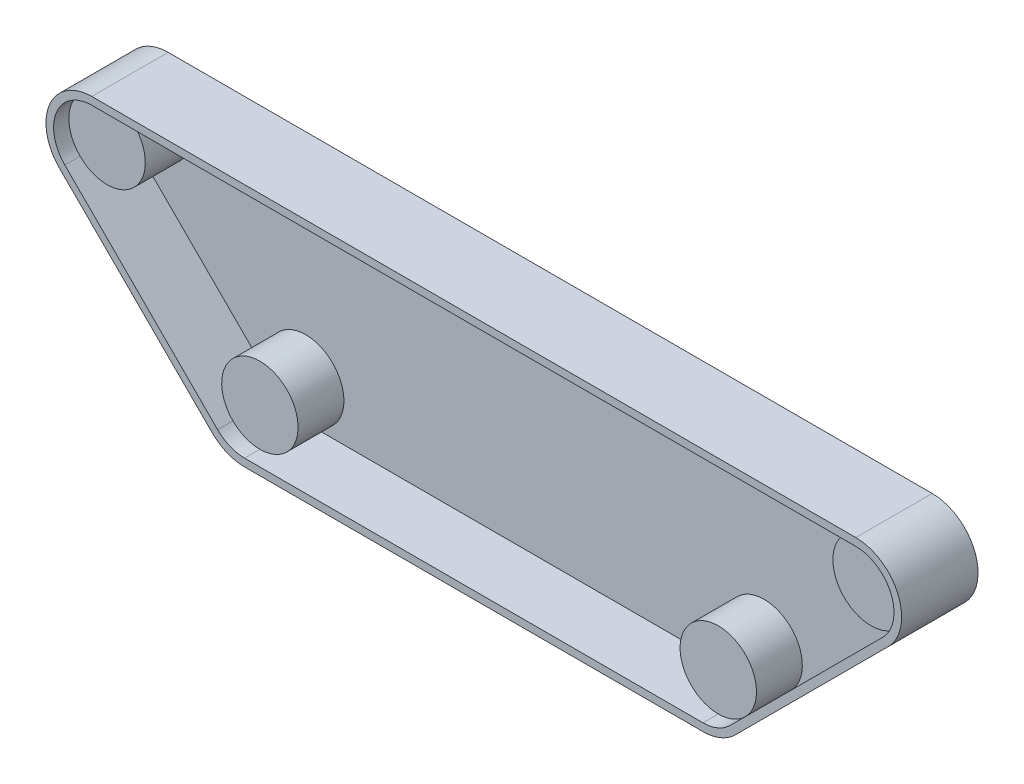
from build123d import *

# Parameters (mm, degrees)
BOSS_EXTRU_1_DEPTH = 20
ESQUISSE2_R        = 50
BOSS_EXTRU_2_DEPTH = 60
BOSS_EXTRU_3_DEPTH = 80


with BuildPart() as part:
    # Esquisse1 → Boss.-Extru.1 (new body)
    with BuildSketch(Plane.XY):
        with BuildLine():
            ThreePointArc((-57.401721965, 73.269601329), (-112.834493915, 36.230607271), (-99.828128836, -29.156805542))
            Line((-99.828128836, -29.156805542), (100.171871164, -229.156805542))
            ThreePointArc((100.171871164, -229.156805542), (119.637272093, -242.163170622), (142.598278035, -246.730398671))
            Line((142.598278035, -246.730398671), (742.598278035, -246.730398671))
            ThreePointArc((742.598278035, -246.730398671), (765.559283977, -242.163170622), (785.024684906, -229.156805542))
            Line((785.024684906, -229.156805542), (985.024684906, -29.156805542))
            ThreePointArc((985.024684906, -29.156805542), (998.031049986, 36.230607271), (942.598278035, 73.269601329))
            Line((942.598278035, 73.269601329), (-57.401721965, 73.269601329))
        make_face()
    extrude(amount=BOSS_EXTRU_1_DEPTH)

    # Esquisse2 → Boss.-Extru.2 (add)
    with BuildSketch(Plane.XY.offset(20)):
        with Locations((-57.401721965, 13.269601329)):
            Circle(ESQUISSE2_R)
        with Locations((942.598278035, 13.269601329)):
            Circle(ESQUISSE2_R)
        with Locations((142.598278035, -186.730398671)):
            Circle(ESQUISSE2_R)
        with Locations((742.598278035, -186.730398671)):
            Circle(ESQUISSE2_R)
    extrude(amount=BOSS_EXTRU_2_DEPTH)

    # Esquisse3 → Boss.-Extru.3 (add)
    with BuildSketch(Plane.XY.offset(20)):
        with BuildLine():
            Line((942.598278035, 73.269601329), (-57.401721965, 73.269601329))
            ThreePointArc((-57.401721965, 73.269601329), (-112.834493915, 36.230607271), (-99.828128836, -29.156805542))
            Line((-99.828128836, -29.156805542), (100.171871164, -229.156805542))
            ThreePointArc((100.171871164, -229.156805542), (119.637272093, -242.163170622), (142.598278035, -246.730398671))
            Line((142.598278035, -246.730398671), (742.598278035, -246.730398671))
            ThreePointArc((742.598278035, -246.730398671), (765.559283977, -242.163170622), (785.024684906, -229.156805542))
            Line((785.024684906, -229.156805542), (985.024684906, -29.156805542))
            ThreePointArc((985.024684906, -29.156805542), (998.031049986, 36.230607271), (942.598278035, 73.269601329))
        make_face()
        with BuildLine():
            ThreePointArc((942.598278035, 63.269601329), (988.792254661, 32.403772947), (977.953617095, -22.08573773))
            Line((977.953617095, -22.08573773), (777.953617095, -222.08573773))
            ThreePointArc((777.953617095, -222.08573773), (761.732449653, -232.924375297), (742.598278035, -236.730398671))
            Line((742.598278035, -236.730398671), (142.598278035, -236.730398671))
            ThreePointArc((142.598278035, -236.730398671), (123.464106417, -232.924375297), (107.242938976, -222.08573773))
            Line((107.242938976, -222.08573773), (-92.757061024, -22.08573773))
            ThreePointArc((-92.757061024, -22.08573773), (-103.59569859, 32.403772947), (-57.401721965, 63.269601329))
            Line((-57.401721965, 63.269601329), (942.598278035, 63.269601329))
        make_face(mode=Mode.SUBTRACT)
    extrude(amount=BOSS_EXTRU_3_DEPTH)


solid = part.part
